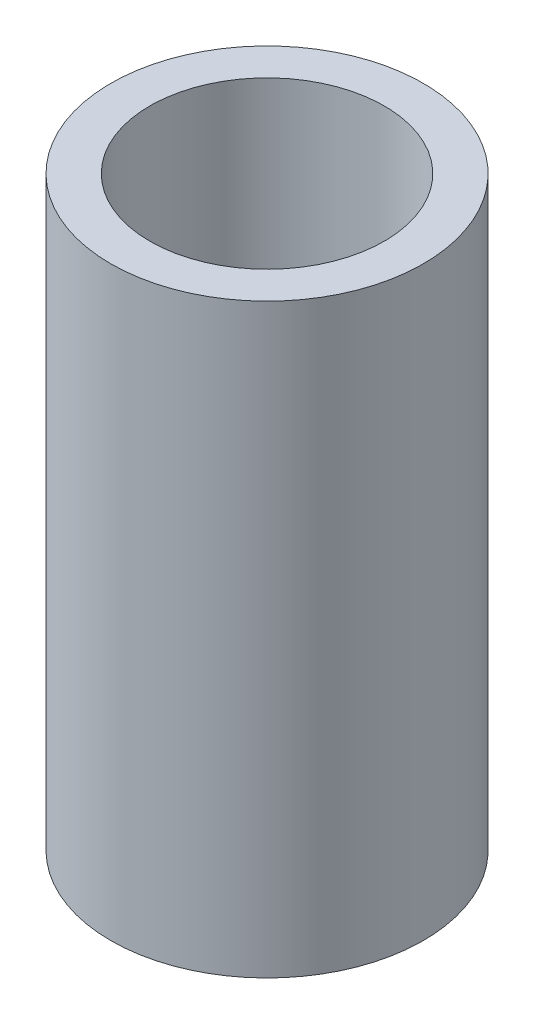
from build123d import *

# Parameters (mm, degrees)
SKETCH_1_R      = 4
SKETCH_1_R_2    = 3
EXTRUDE_1_DEPTH = 15


with BuildPart() as part:
    # 草图1 → 凸台-拉伸1 (new body)
    with BuildSketch(Plane(origin=(0, 0, 0), x_dir=(1, 0, 0), z_dir=(0, 1, 0))):
        with Locations(Location((0, 0, 0), (0, 0, 270))):
            Circle(SKETCH_1_R)
        with Locations(Location((0, 0, 0), (0, 0, 270))):
            Circle(SKETCH_1_R_2, mode=Mode.SUBTRACT)
    extrude(amount=EXTRUDE_1_DEPTH)


solid = part.part
